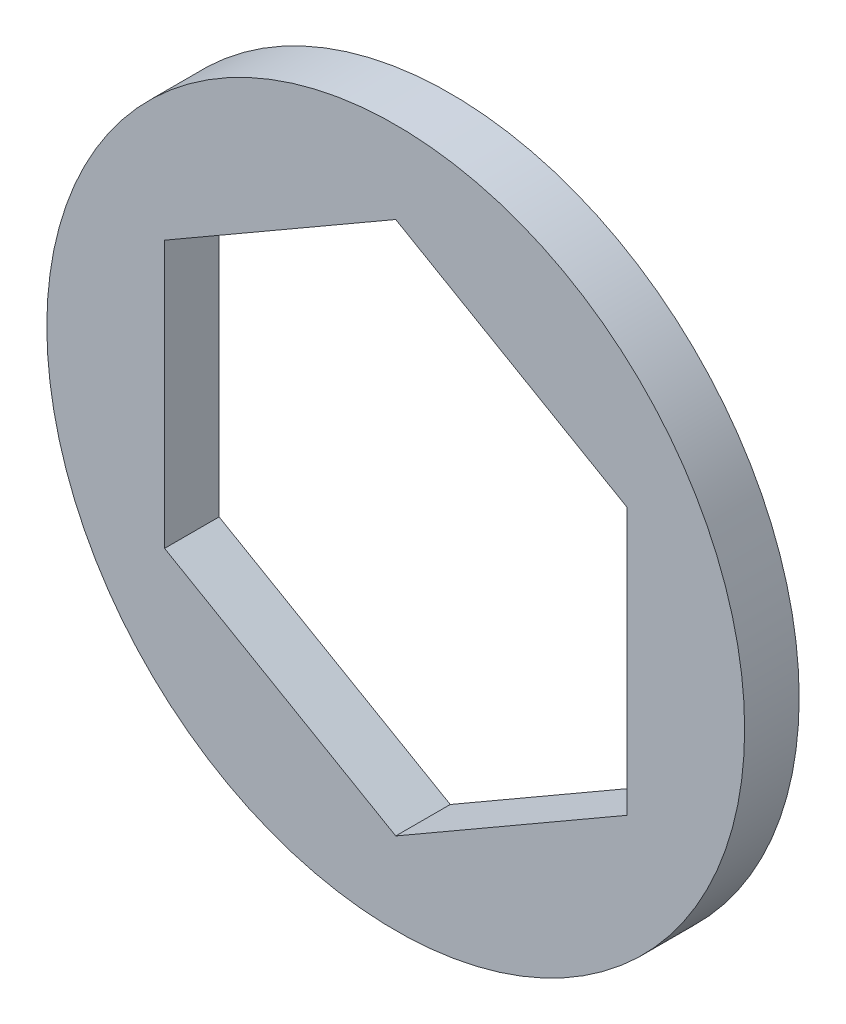
from build123d import *

# Parameters (mm, degrees)
SKETCH1_R           = 10.16
BOSS_EXTRUDE1_DEPTH = 0.79375


with BuildPart() as part:
    # Sketch1 → Boss-Extrude1 (new, symmetric)
    with BuildSketch(Plane.XY):
        Circle(SKETCH1_R)
        Polygon((0, 7.772289324), (-6.731, 3.886144662), (-6.731, -3.886144662), (0, -7.772289324), (6.731, -3.886144662), (6.731, 3.886144662), align=None, mode=Mode.SUBTRACT)
    extrude(amount=BOSS_EXTRUDE1_DEPTH, both=True)


solid = part.part
